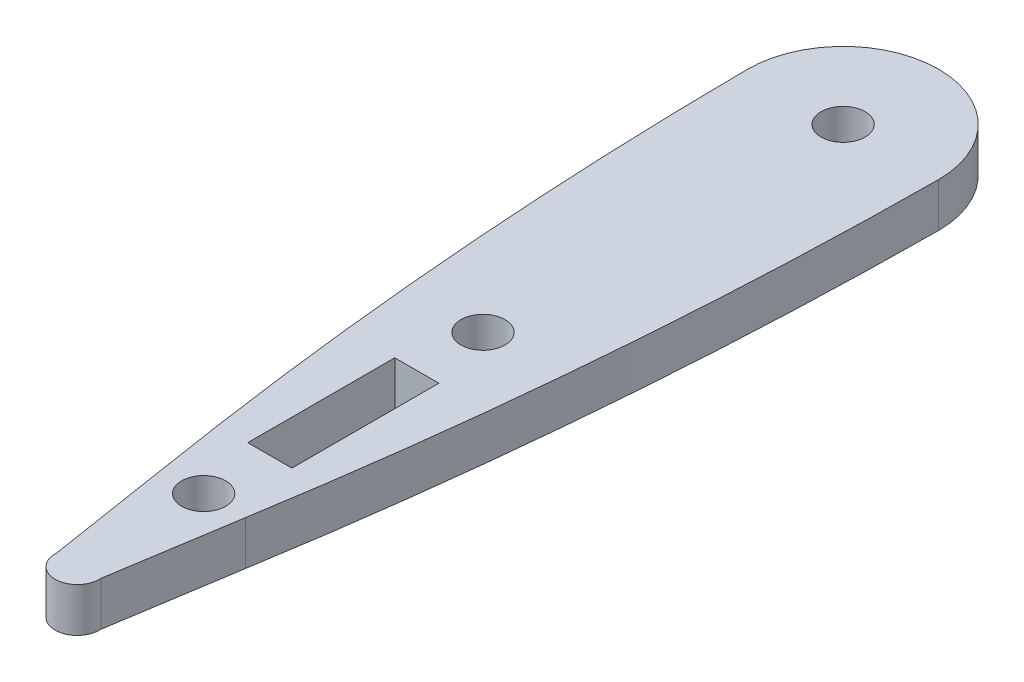
from build123d import *

# Parameters (mm, degrees)
ESBO_O1_R                = 1.5
RESSALTO_EXTRUS_O1_DEPTH = 3


with BuildPart() as part:
    # Esboço1 → Ressalto-extrusão1 (new body)
    with BuildSketch(Plane(origin=(0, 0, 0), x_dir=(1, 0, 0), z_dir=(0, 1, 0))):
        with BuildLine():
            Line((-2.838975028, -25.45488959), (-1.5, -33.95488959))
            ThreePointArc((-1.5, -33.95488959), (0, -35.556863977), (1.5, -33.95488959))
            Line((1.5, -33.95488959), (2.838975028, -25.45488959))
            ThreePointArc((2.838975028, -25.45488959), (5.508963035, -3.818784756), (6.499428658, 17.958929684))
            ThreePointArc((6.499428658, 17.958929684), (6.499717622, 18.002020025), (6.5, 18.04511041))
            ThreePointArc((6.5, 18.04511041), (0, 24.54511041), (-6.5, 18.04511041))
            ThreePointArc((-6.5, 18.04511041), (-6.499717622, 18.002020025), (-6.499428658, 17.958929683))
            ThreePointArc((-6.499428658, 17.958929683), (-5.508963035, -3.818784756), (-2.838975028, -25.45488959))
        make_face()
        with Locations(Location((0, -25.45488959, 0), (0, 0, 270))):
            Circle(ESBO_O1_R, mode=Mode.SUBTRACT)
        Polygon((-1.5, -10.95488959), (0, -10.95488959), (1.5, -10.95488959), (1.5, -20.95488959), (0, -20.95488959), (-1.5, -20.95488959), align=None, mode=Mode.SUBTRACT)
        with Locations(Location((0, -6.45488959, 0), (0, 0, 270))):
            Circle(ESBO_O1_R, mode=Mode.SUBTRACT)
        with Locations(Location((0, 18.04511041, 0), (0, 0, 270))):
            Circle(ESBO_O1_R, mode=Mode.SUBTRACT)
    extrude(amount=RESSALTO_EXTRUS_O1_DEPTH)


solid = part.part
